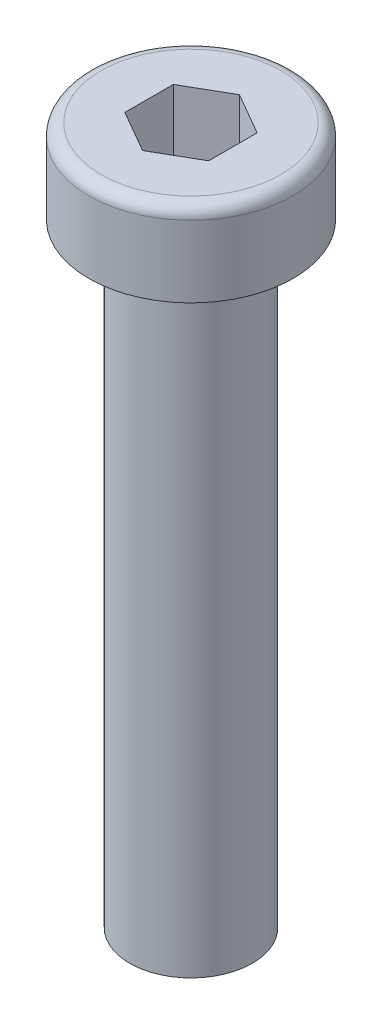
from build123d import *

# Parameters (mm, degrees)
SKETCH1_R           = 5
BOSS_EXTRUDE1_DEPTH = 4.1
FILLET1_R           = 0.6
CUT_EXTRUDE1_DEPTH  = 3.6
SKETCH3_R           = 3
BOSS_EXTRUDE2_DEPTH = 30


with BuildPart() as part:
    # Sketch1 → Boss-Extrude1 (new body)
    with BuildSketch(Plane(origin=(0, 0, 0), x_dir=(1, 0, 0), z_dir=(0, 1, 0))):
        with Locations(Location((0, 0, 0), (0, 0, 270))):
            Circle(SKETCH1_R)
    extrude(amount=BOSS_EXTRUDE1_DEPTH)

    # Fillet1
    fillet1_edges = [part.edges().sort_by_distance(p)[0] for p in [
        (0, 4.1, -5),
    ]]
    fillet(fillet1_edges, radius=FILLET1_R)

    # Sketch2 → Cut-Extrude1 (cut)
    with BuildSketch(Plane(origin=(0, 4.1, 0), x_dir=(1, 0, 0), z_dir=(0, 1, 0))):
        Polygon((0, -2.367136104), (2.05, -1.183568052), (2.05, 1.183568052), (0, 2.367136104), (-2.05, 1.183568052), (-2.05, -1.183568052), align=None)
    extrude(amount=-CUT_EXTRUDE1_DEPTH, mode=Mode.SUBTRACT)

    # Sketch3 → Boss-Extrude2 (add)
    with BuildSketch(Plane.XZ):
        with Locations(Location((0, 0, 0), (0, 0, 270))):
            Circle(SKETCH3_R)
    extrude(amount=BOSS_EXTRUDE2_DEPTH)


solid = part.part
